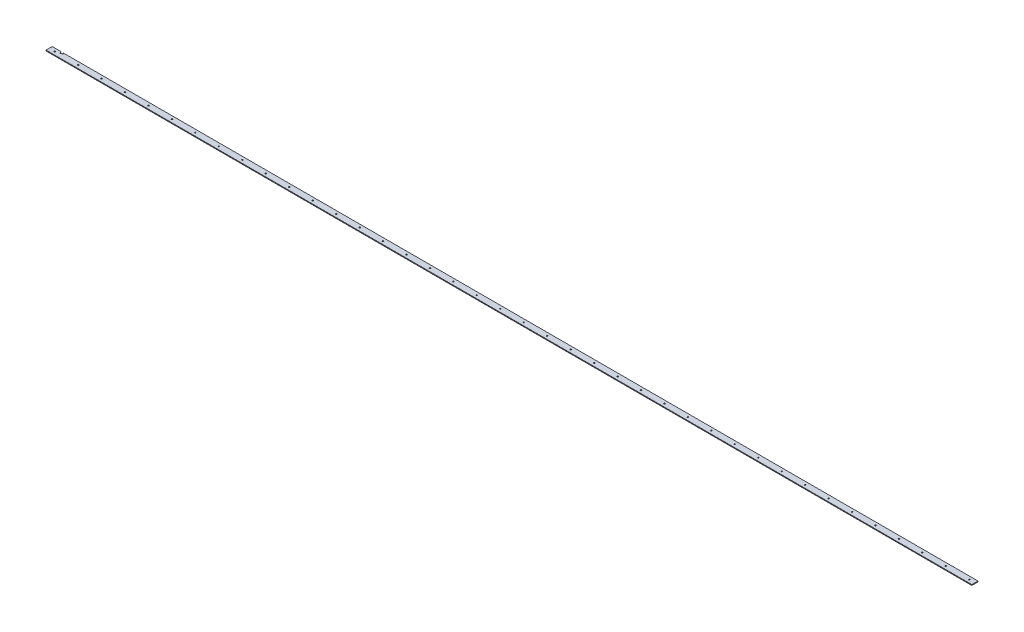
from build123d import *

# Parameters (mm, degrees)
IZIM1_W                     = 6000
IZIM1_H                     = 40
Y_KSEKLIK_EKSTR_ZYON1_DEPTH = 5
IZIM2_R                     = 4
KES_EKSTR_ZYON1_DEPTH       = 5
L_O_ALTMA1_COUNT            = 40
L_O_ALTMA1_PITCH            = 152
KES_EKSTR_ZYON2_DEPTH       = 5


with BuildPart() as part:
    # Çizim1 → Yükseklik-Ekstrüzyon1 (new body)
    with BuildSketch(Plane(origin=(0, 0, 0), x_dir=(1, 0, 0), z_dir=(0, 1, 0))):
        Rectangle(IZIM1_W, IZIM1_H)
    extrude(amount=Y_KSEKLIK_EKSTR_ZYON1_DEPTH)

    # Çizim2 → Kes-Ekstrüzyon1 (cut)
    with BuildSketch(Plane(origin=(0, 5, 0), x_dir=(1, 0, 0), z_dir=(0, 1, 0))):
        with Locations(Location((-2964, 0, 0), (0, 0, 270))):
            Circle(IZIM2_R)
    kes_ekstr_zyon1 = extrude(amount=-KES_EKSTR_ZYON1_DEPTH, mode=Mode.SUBTRACT)

    # LÇoğaltma1: Kes-Ekstrüzyon1 ×40
    with Locations(*[(i * L_O_ALTMA1_PITCH, 0, 0) for i in range(1, L_O_ALTMA1_COUNT)]):
        add(kes_ekstr_zyon1, mode=Mode.SUBTRACT)

    # Çizim3 → Kes-Ekstrüzyon2 (cut)
    with BuildSketch(Plane(origin=(0, 5, 0), x_dir=(1, 0, 0), z_dir=(0, 1, 0))):
        Polygon((-2943.570103911, 20), (-2936.111815354, 6.401329737), (-2919.083902826, 15.74041089), (-2929.585812867, 20), align=None)
    extrude(amount=-KES_EKSTR_ZYON2_DEPTH, mode=Mode.SUBTRACT)


solid = part.part
